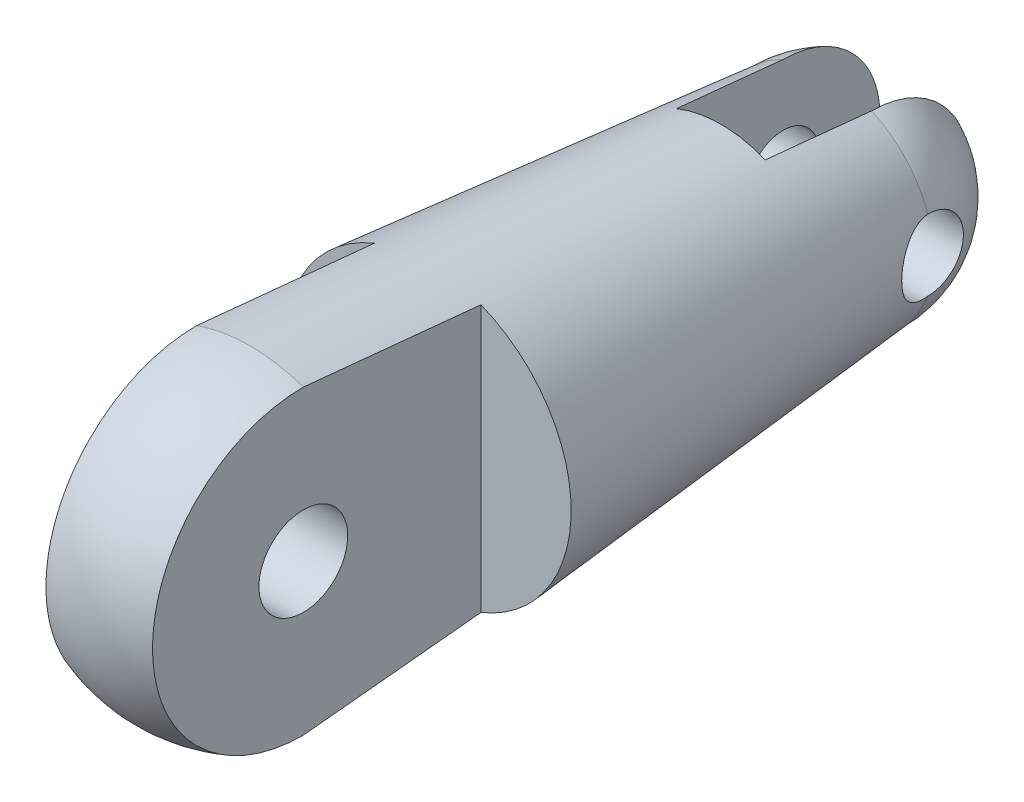
from build123d import *

# Parameters (mm, degrees)
SKETCH2_R          = 5
SKETCH2_R_2        = 4
CUT_EXTRUDE1_DEPTH = 30
SKETCH3_W          = 20.330301562
SKETCH3_H          = 41.442025473
SKETCH3_W_2        = 16.200064503
SKETCH3_H_2        = 44.818824912
CUT_EXTRUDE2_DEPTH = 20
SKETCH4_W          = 10
SKETCH4_H          = 24
CUT_EXTRUDE3_DEPTH = 20


with BuildPart() as part:
    # Sketch1 → Revolve1 (revolve)
    with BuildSketch(Plane(origin=(0, 0, 0), x_dir=(0, 0, -1), z_dir=(1, 0, 0))):
        with BuildLine():
            Line((-18, 0), (77, 0))
            ThreePointArc((77, 0), (73.485281374, 8.485281374), (65, 12))
            Line((65, 12), (0, 18))
            ThreePointArc((0, 18), (-12.727922061, 12.727922061), (-18, 0))
        make_face()
    revolve(axis=Axis((0, 0, 43.473022029), (0, 0, -1)))

    # Sketch2 → Cut-Extrude1 (cut, symmetric)
    with BuildSketch(Plane(origin=(0, 0, 0), x_dir=(0, 0, -1), z_dir=(1, 0, 0))):
        with Locations(Location((0, 0, 0), (0, 0, 270))):
            Circle(SKETCH2_R)
        with Locations(Location((65, 0, 0), (0, 0, 90))):
            Circle(SKETCH2_R_2)
    extrude(amount=CUT_EXTRUDE1_DEPTH, both=True, mode=Mode.SUBTRACT)

    # Sketch3 → Cut-Extrude2 (cut, symmetric)
    with BuildSketch(Plane(origin=(0, 0, 0), x_dir=(1, 0, 0), z_dir=(0, 1, 0))):
        with Locations((-16.165150781, -0.721012737)):
            Rectangle(SKETCH3_W, SKETCH3_H)
        with Locations((14.100032252, -2.409412456)):
            Rectangle(SKETCH3_W_2, SKETCH3_H_2)
    extrude(amount=CUT_EXTRUDE2_DEPTH, both=True, mode=Mode.SUBTRACT)

    # Sketch4 → Cut-Extrude3 (cut, symmetric)
    with BuildSketch(Plane(origin=(0, 0, 0), x_dir=(1, 0, 0), z_dir=(0, 1, 0))):
        with Locations((0, 65)):
            Rectangle(SKETCH4_W, SKETCH4_H)
    extrude(amount=CUT_EXTRUDE3_DEPTH, both=True, mode=Mode.SUBTRACT)


solid = part.part
